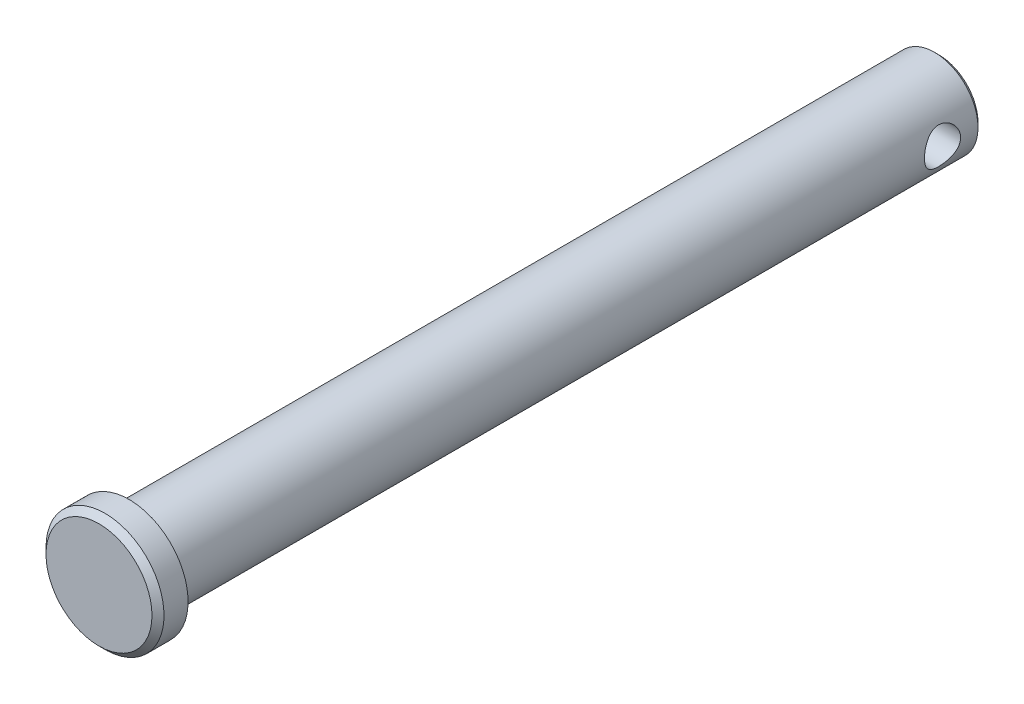
from build123d import *

# Parameters (mm, degrees)
SKETCH1_R           = 4.7625
EXTRUDE1_DEPTH      = 44.45
SKETCH2_R           = 6.477
EXTRUDE2_DEPTH      = 3.302
CHAMFER1_SIZE       = 0.6604
EXTRUDE3_DEPTH      = 49.622593123
EXTRUDE3_DEPTH_BACK = 49.622593123
SKETCH3_R           = 1.984375
CHAMFER2_SIZE       = 0.47625


with BuildPart() as part:
    # Sketch1 → Extrude1 (new, symmetric)
    with BuildSketch(Plane.XY):
        Circle(SKETCH1_R)
    extrude(amount=EXTRUDE1_DEPTH, both=True)

    # Sketch2 → Extrude2 (add)
    with BuildSketch(Plane.XY.offset(44.45)):
        with Locations(Location((0, 0, 0), (0, 0, 180))):
            Circle(SKETCH2_R)
    extrude(amount=EXTRUDE2_DEPTH)

    # Chamfer1
    chamfer1_edges = [part.edges().sort_by_distance(p)[0] for p in [
        (6.477, 0, 47.752),
    ]]
    chamfer(chamfer1_edges, length=CHAMFER1_SIZE)

    # Sketch3 → Extrude3 (cut, two sides: drawn at the far end of the back side and taken through both)
    with BuildSketch(Plane(origin=(0, 0, 0), x_dir=(0, 0, -1), z_dir=(1, 0, 0)).offset(-EXTRUDE3_DEPTH_BACK)):
        with Locations(Location((40.084375, 0, 0), (0, 0, 180.000000002))):
            Circle(SKETCH3_R)
    extrude(amount=EXTRUDE3_DEPTH + EXTRUDE3_DEPTH_BACK, mode=Mode.SUBTRACT)

    # Chamfer2
    chamfer2_edges = [part.edges().sort_by_distance(p)[0] for p in [
        (-4.7625, 0, -44.45),
    ]]
    chamfer(chamfer2_edges, length=CHAMFER2_SIZE)


solid = part.part
